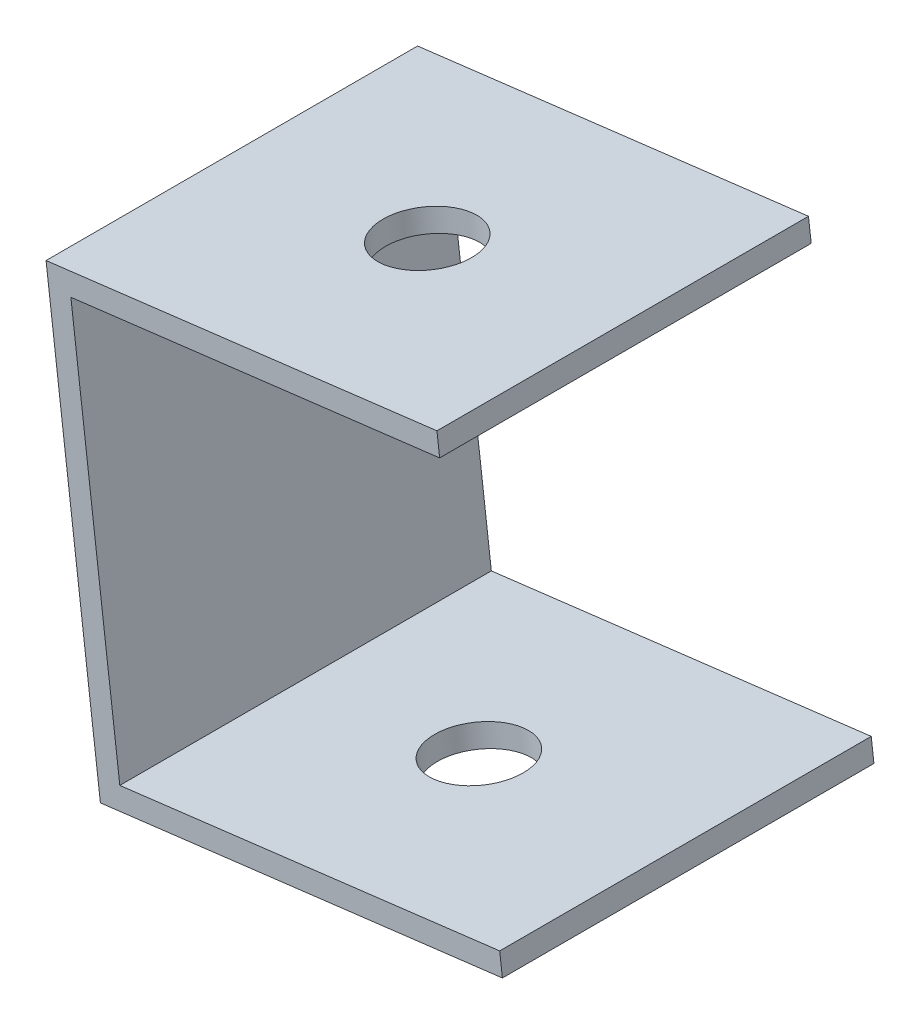
from build123d import *

# Parameters (mm, degrees)
BOSS_EXTRUDE1_DEPTH = 50
CUT_EXTRUDE1_REACH  = 101.087
SKETCH2_R           = 6


with BuildPart() as part:
    # Sketch1 → Boss-Extrude1 (new body)
    with BuildSketch(Plane.XY):
        Polygon((0, 0), (-7.312160604, 59.552769098), (45.292785433, 66.011844299), (45.658393463, 63.034205844), (-3.968914119, 56.940738674), (2.612030425, 3.343246485), (53.736588097, 9.62055285), (54.102196127, 6.642914395), align=None)
    extrude(amount=BOSS_EXTRUDE1_DEPTH)

    # Cut-Extrude1: up to this face of the body (flat: up to its plane)
    cut_extrude1_end = Plane(part.part.faces().sort_by_distance((27.051098064, 3.321457198, 25))[0])
    # Sketch2 → Cut-Extrude1 (cut, up to the picked face)
    with BuildSketch(Plane(origin=(-7.312160604, 59.552769098, 0), x_dir=(0.9925461516413224, 0.12186934340514483, 0), z_dir=(-0.12186934340514483, 0.9925461516413224, 0)), mode=Mode.PRIVATE) as cut_extrude1_sk1:
        with Locations(Location((26.5, -25, 0), (0, 0, 180))):
            Circle(SKETCH2_R)
    cut_extrude1_tool1 = split(extrude(cut_extrude1_sk1.sketch, amount=-CUT_EXTRUDE1_REACH, mode=Mode.PRIVATE), bisect_by=cut_extrude1_end, keep=Keep.BOTH, mode=Mode.PRIVATE)
    add(cut_extrude1_tool1.solids().sort_by(Axis((18.990312, 62.782307, 25), (0.12186934340514483, -0.9925461516413224, 0)))[0], mode=Mode.SUBTRACT)


solid = part.part
